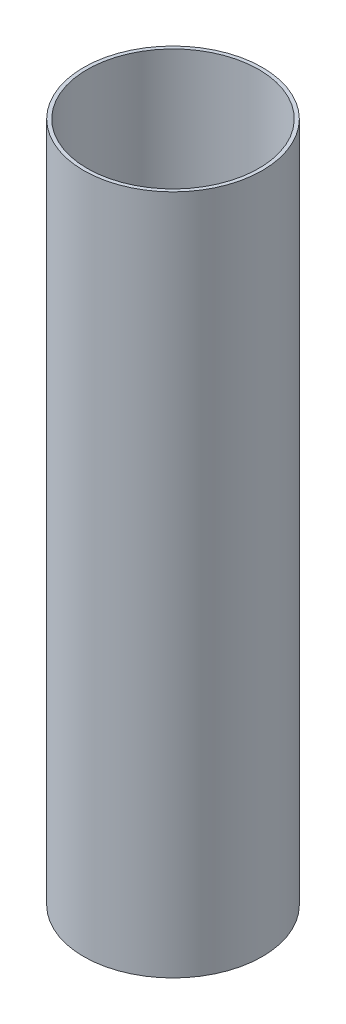
from build123d import *

# Parameters (mm, degrees)
SKETCH_1_R      = 50
SKETCH_1_R_2    = 48
EXTRUDE_1_DEPTH = 381


with BuildPart() as part:
    # Эскиз1 → Бобышка-Вытянуть1 (new body)
    with BuildSketch(Plane(origin=(0, 0, 0), x_dir=(1, 0, 0), z_dir=(0, 1, 0))):
        with Locations(Location((0, 0, 0), (0, 0, 270))):
            Circle(SKETCH_1_R)
        with Locations(Location((0, 0, 0), (0, 0, 270))):
            Circle(SKETCH_1_R_2, mode=Mode.SUBTRACT)
    extrude(amount=EXTRUDE_1_DEPTH)


solid = part.part
